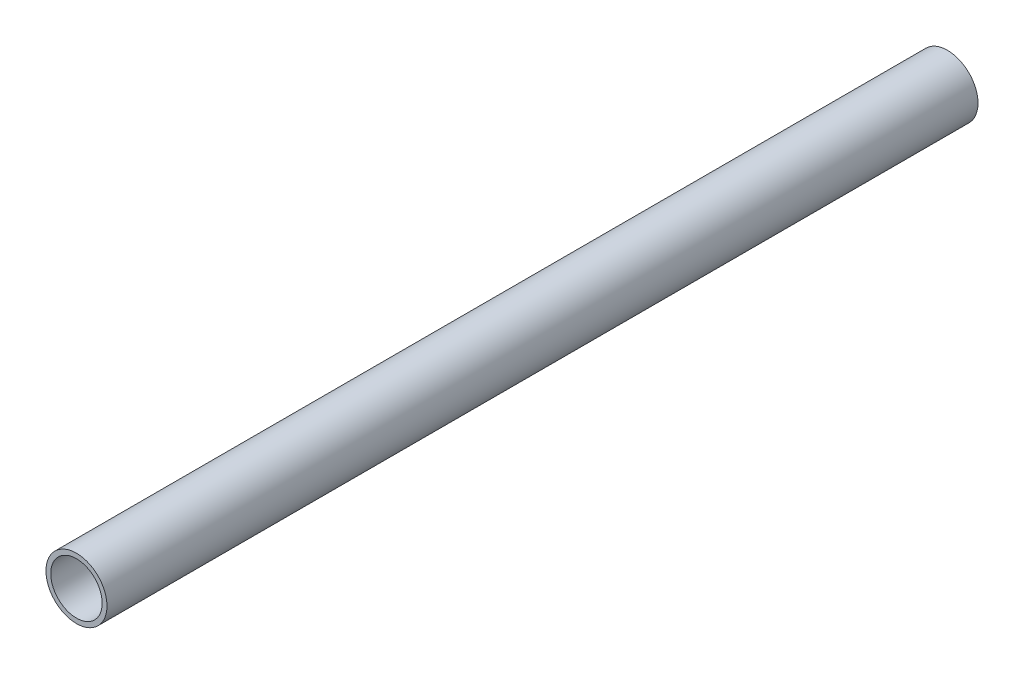
from build123d import *

# Parameters (mm, degrees)
SKETCH3_R           = 7.9375
SKETCH3_R_2         = 6.6929
BOSS_EXTRUDE1_DEPTH = 113.296195937


with BuildPart() as part:
    # Sketch3 → Boss-Extrude1 (new, symmetric)
    with BuildSketch(Plane.XY):
        Circle(SKETCH3_R)
        Circle(SKETCH3_R_2, mode=Mode.SUBTRACT)
    extrude(amount=BOSS_EXTRUDE1_DEPTH, both=True)


solid = part.part
